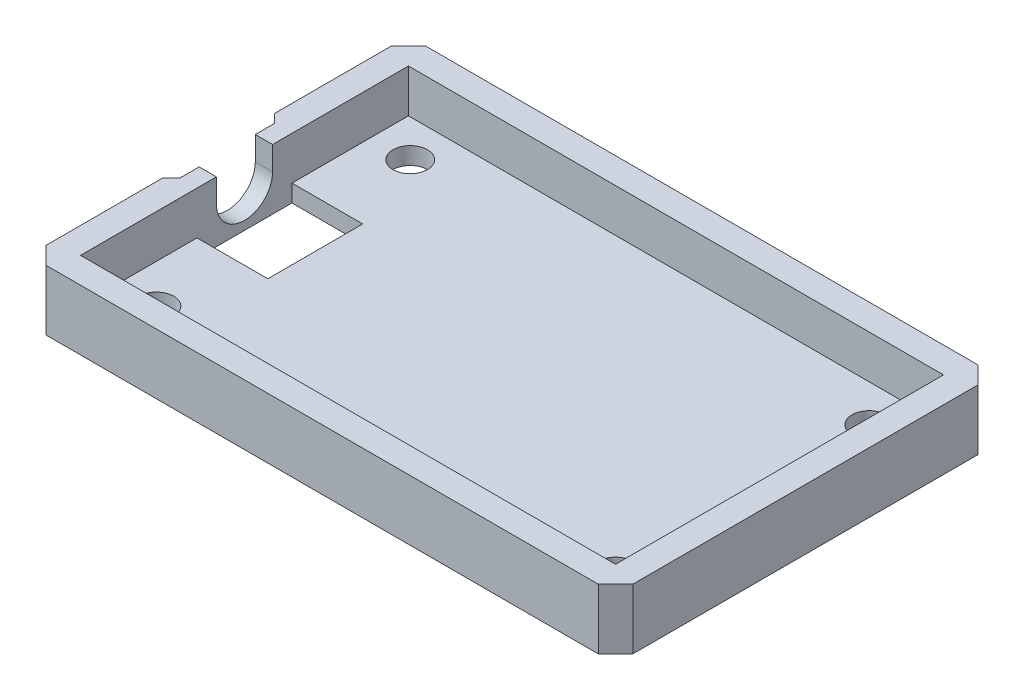
from build123d import *

# Parameters (mm, degrees)
BOSS_EXTRUDE1_DEPTH = 5
SKETCH2_W           = 68
SKETCH2_H           = 44
BOSS_EXTRUDE2_DEPTH = 2
SKETCH3_W           = 11
SKETCH3_H           = 2
CUT_EXTRUDE1_DEPTH  = 11.2
CHAMFER1_SIZE       = 1
SKETCH4_R           = 2
CUT_EXTRUDE2_DEPTH  = 10
SKETCH6_W           = 2
SKETCH6_H           = 7
BOSS_EXTRUDE3_DEPTH = 20
CUT_EXTRUDE3_DEPTH  = 5
CHAMFER2_SIZE       = 2


with BuildPart() as part:
    # Sketch1 → Boss-Extrude1 (new body)
    with BuildSketch(Plane(origin=(0, 0, 0), x_dir=(1, 0, 0), z_dir=(0, 1, 0))):
        Polygon((-33.284090909, -14.318181818), (-33.284090909, -27.818181818), (28.715909091, -27.818181818), (28.715909091, 10.181818182), (-33.284090909, 10.181818182), (-33.284090909, -3.318181818), (-36.284090909, -3.318181818), (-36.284090909, 13.181818182), (31.715909091, 13.181818182), (31.715909091, -30.818181818), (-36.284090909, -30.818181818), (-36.284090909, -14.318181818), align=None)
    extrude(amount=BOSS_EXTRUDE1_DEPTH)

    # Sketch2 → Boss-Extrude2 (add)
    with BuildSketch(Plane.XZ):
        with Locations((-2.284090909, 8.818181818)):
            Rectangle(SKETCH2_W, SKETCH2_H)
    extrude(amount=BOSS_EXTRUDE2_DEPTH)

    # Sketch3 → Cut-Extrude1 (cut)
    with BuildSketch(Plane.ZY.offset(36.284090909)):
        with Locations((8.818181818, -1)):
            Rectangle(SKETCH3_W, SKETCH3_H)
    extrude(amount=-CUT_EXTRUDE1_DEPTH, mode=Mode.SUBTRACT)

    # Chamfer1
    chamfer1_edges = [part.edges().sort_by_distance(p)[0] for p in [
        (-36.284090909, 1.5, 3.318181818),
        (-36.284090909, 1.5, 14.318181818),
    ]]
    chamfer(chamfer1_edges, length=CHAMFER1_SIZE)

    # Sketch4 → Cut-Extrude2 (cut)
    with BuildSketch(Plane(origin=(0, 0, 0), x_dir=(1, 0, 0), z_dir=(0, 1, 0))):
        with Locations(Location((24.415909091, 5.881818182, 0), (0, 0, 270))):
            Circle(SKETCH4_R)
        with Locations(Location((24.415909091, -23.518181818, 0), (0, 0, 270))):
            Circle(SKETCH4_R)
        with Locations(Location((-28.784090909, -23.518181818, 0), (0, 0, 270))):
            Circle(SKETCH4_R)
        with Locations(Location((-28.784090909, 5.881818182, 0), (0, 0, 270))):
            Circle(SKETCH4_R)
    extrude(amount=-CUT_EXTRUDE2_DEPTH, mode=Mode.SUBTRACT)

    # Sketch6 → Boss-Extrude3 (add)
    with BuildSketch(Plane(origin=(0, 0, 14.318181818), x_dir=(-1, 0, 0), z_dir=(0, 0, -1))):
        with Locations((34.284090909, 1.5)):
            Rectangle(SKETCH6_W, SKETCH6_H)
    extrude(amount=BOSS_EXTRUDE3_DEPTH)

    # Sketch7 → Cut-Extrude3 (cut)
    with BuildSketch(Plane.ZY.offset(35.284090909)):
        with BuildLine():
            Line((5.568181818, 2.25), (5.568181818, 5))
            Line((5.568181818, 5), (12.068181818, 5))
            Line((12.068181818, 5), (12.068181818, 2.25))
            ThreePointArc((12.068181818, 2.25), (8.818181818, -1), (5.568181818, 2.25))
        make_face()
    extrude(amount=-CUT_EXTRUDE3_DEPTH, mode=Mode.SUBTRACT)

    # Chamfer2
    chamfer2_edges = [part.edges().sort_by_distance(p)[0] for p in [
        (-36.284090909, 1.5, -13.181818182),
        (31.715909091, 1.5, -13.181818182),
        (31.715909091, 1.5, 30.818181818),
        (-36.284090909, 1.5, 30.818181818),
    ]]
    chamfer(chamfer2_edges, length=CHAMFER2_SIZE)


solid = part.part
